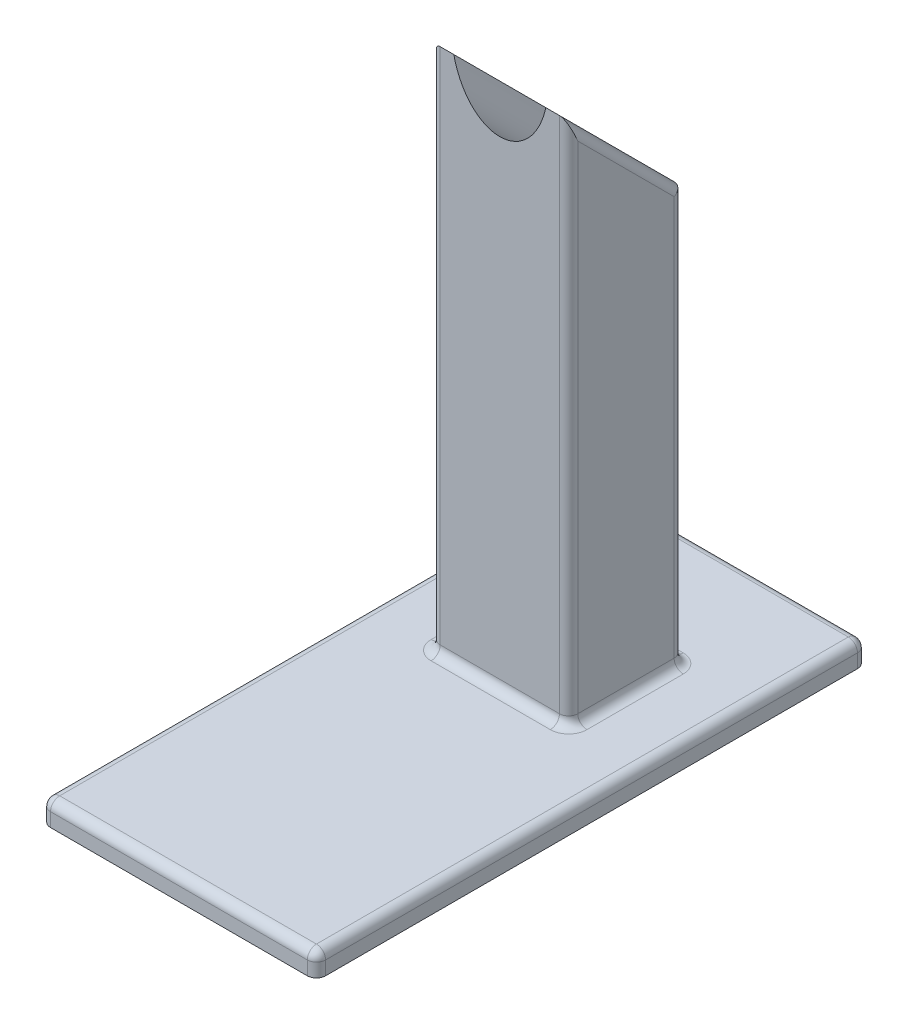
from build123d import *

# Parameters (mm, degrees)
SKETCH1_W                = 76.2
SKETCH1_H                = 152.4
BOSS_EXTRUDE1_DEPTH      = 6.35
BOSS_EXTRUDE2_DEPTH      = 19.05
BOSS_EXTRUDE2_DEPTH_BACK = 19.05
SKETCH4_R                = 13.335
CUT_EXTRUDE1_DEPTH       = 175.596133978
FILLET1_R                = 2.54


with BuildPart() as part:
    # Sketch1 → Boss-Extrude1 (new body)
    with BuildSketch(Plane(origin=(0, 0, 0), x_dir=(1, 0, 0), z_dir=(0, 1, 0))):
        Rectangle(SKETCH1_W, SKETCH1_H)
    extrude(amount=BOSS_EXTRUDE1_DEPTH)

    # Sketch3 → Boss-Extrude2 (add, two sides: drawn at the far end of the back side and taken through both)
    with BuildSketch(Plane(origin=(0, 0, 0), x_dir=(0, 0, -1), z_dir=(1, 0, 0)).offset(-BOSS_EXTRUDE2_DEPTH_BACK)):
        Polygon((12.7, 6.35), (12.7, 152.4), (44.45, 120.65), (44.45, 6.35), align=None)
    extrude(amount=BOSS_EXTRUDE2_DEPTH + BOSS_EXTRUDE2_DEPTH_BACK)

    # Sketch4 → Cut-Extrude1 (cut, through all)
    with BuildSketch(Plane(origin=(0, 0, 0), x_dir=(1, 0, 0), z_dir=(0, 0.7071067811865486, 0.7071067811865465))):
        with Locations((0, 120.65)):
            Circle(SKETCH4_R)
    extrude(amount=CUT_EXTRUDE1_DEPTH, mode=Mode.SUBTRACT)

    # Fillet1
    fillet1_edges = [part.edges().sort_by_distance(p)[0] for p in [
        (-38.1, 6.35, 0),
        (0, 6.35, -44.45),
        (-19.05, 6.35, -28.575),
        (0, 6.35, -12.7),
        (19.05, 79.375, -12.7),
        (19.05, 136.525, -28.575),
        (0, 6.35, 76.2),
        (19.05, 63.5, -44.45),
        (-19.05, 79.375, -12.7),
        (-19.05, 136.525, -28.575),
        (-19.05, 63.5, -44.45),
        (19.05, 6.35, -28.575),
        (38.1, 6.35, 0),
        (38.1, 3.175, 76.2),
        (-38.1, 3.175, 76.2),
        (-38.1, 3.175, -76.2),
        (38.1, 3.175, -76.2),
        (0, 6.35, -76.2),
    ]]
    fillet(fillet1_edges, radius=FILLET1_R)


solid = part.part
